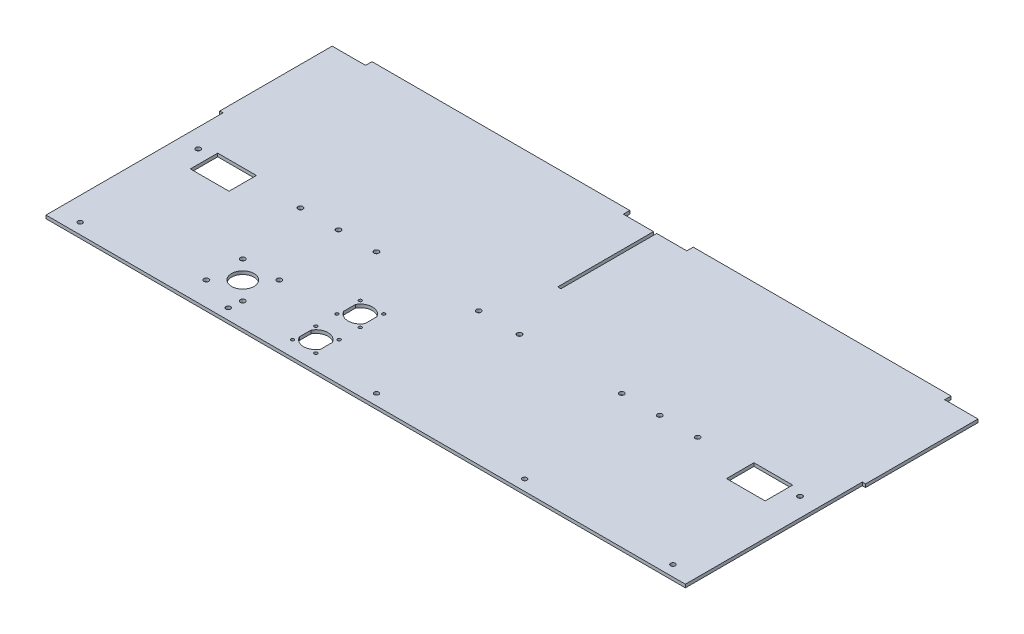
from build123d import *

# Parameters (mm, degrees)
SKETCH1_W            = 629.90984
SKETCH1_H            = 147.69846
BOSS_EXTRUDE1_DEPTH  = 3.175
SKETCH3_W            = 254
SKETCH3_H            = 3.175
BOSS_EXTRUDE2_DEPTH  = 6.35
SKETCH4_W            = 3.175
SKETCH4_H            = 188.732840052
CUT_EXTRUDE1_DEPTH   = 3.175
SKETCH6_W            = 3.175
SKETCH6_H            = 110.773845
BOSS_EXTRUDE4_DEPTH  = 3.175
SKETCH8_W            = 629.90984
SKETCH8_H            = 18.04416
BOSS_EXTRUDE5_DEPTH  = 3.175
SKETCH10_W           = 38.1
SKETCH10_H           = 36.08832
CUT_EXTRUDE3_DEPTH   = 652.56536379
BOSS_EXTRUDE6_DEPTH  = 3.175
SKETCH13_R           = 1.55
SKETCH13_R_2         = 11.049
CUT_EXTRUDE4_DEPTH   = 652.56536379
SKETCH20_W           = 20.59499956
SKETCH20_H           = 2.942142794
CUT_EXTRUDE7_DEPTH   = 1.27
SKETCH21_R           = 2.25
CUT_EXTRUDE8_DEPTH   = 652.56536379
SKETCH27_R           = 2.4
CUT_EXTRUDE12_DEPTH  = 652.56536379
M4_CLEARANCE_HOLE2_D = 4.8


with BuildPart() as part:
    # Sketch1 → Boss-Extrude1 (new body)
    with BuildSketch(Plane(origin=(0, 0, 0), x_dir=(1, 0, 0), z_dir=(0, 1, 0))):
        with Locations((314.95492, 73.84923)):
            Rectangle(SKETCH1_W, SKETCH1_H)
    extrude(amount=BOSS_EXTRUDE1_DEPTH)

    # Sketch3 → Boss-Extrude2 (add)
    with BuildSketch(Plane(origin=(0, 0, -147.69846), x_dir=(-1, 0, 0), z_dir=(0, 0, -1))):
        with Locations((-473.22613, 1.5875)):
            Rectangle(SKETCH3_W, SKETCH3_H)
        with Locations((-156.68371, 1.5875)):
            Rectangle(SKETCH3_W, SKETCH3_H)
    extrude(amount=BOSS_EXTRUDE2_DEPTH)

    # Sketch4 → Cut-Extrude1 (cut)
    with BuildSketch(Plane(origin=(0, 3.175, 0), x_dir=(1, 0, 0), z_dir=(0, 1, 0))):
        with Locations((314.95492, 147.69846)):
            Rectangle(SKETCH4_W, SKETCH4_H)
    extrude(amount=-CUT_EXTRUDE1_DEPTH, mode=Mode.SUBTRACT)

    # Sketch6 → Boss-Extrude4 (add)
    with BuildSketch(Plane(origin=(0, 3.175, 0), x_dir=(1, 0, 0), z_dir=(0, 1, 0))):
        with Locations((631.49734, 92.3115375)):
            Rectangle(SKETCH6_W, SKETCH6_H)
        with Locations((-1.5875, 92.3115375)):
            Rectangle(SKETCH6_W, SKETCH6_H)
    extrude(amount=-BOSS_EXTRUDE4_DEPTH)

    # Sketch8 → Boss-Extrude5 (add, through all)
    with BuildSketch(Plane(origin=(0, 3.175, 0), x_dir=(1, 0, 0), z_dir=(0, 1, 0))):
        with Locations((314.95492, -9.02208)):
            Rectangle(SKETCH8_W, SKETCH8_H)
    extrude(amount=-BOSS_EXTRUDE5_DEPTH)

    # Sketch10 → Cut-Extrude3 (cut, through all)
    with BuildSketch(Plane(origin=(0, 3.175, 0), x_dir=(1, 0, 0), z_dir=(0, 1, 0))):
        with Locations((579.10984, -18.04416)):
            Rectangle(SKETCH10_W, SKETCH10_H)
        with Locations((50.8, -18.04416)):
            Rectangle(SKETCH10_W, SKETCH10_H)
    extrude(amount=-CUT_EXTRUDE3_DEPTH, mode=Mode.SUBTRACT)

    # Sketch11 → Boss-Extrude6 (add, through all)
    with BuildSketch(Plane(origin=(0, 3.175, 0), x_dir=(1, 0, 0), z_dir=(0, 1, 0))):
        Polygon((0, -18.04416), (0, -137.42416), (629.90984, -137.42416), (629.90984, -18.04416), (598.15984, -18.04416), (598.15984, -27.06624), (560.05984, -27.06624), (560.05984, -18.04416), (386.39242, -18.04416), (348.29242, -18.04416), (281.61742, -18.04416), (243.51742, -18.04416), (69.85, -18.04416), (69.85, -26.95194), (31.75, -26.95194), (31.75, -18.04416), align=None)
    extrude(amount=-BOSS_EXTRUDE6_DEPTH)

    # Sketch13 → Cut-Extrude4 (cut, through all)
    with BuildSketch(Plane.XZ):
        with Locations(Location((227.731580951, 99.331796051, 0), (0, 0, 270))):
            Circle(SKETCH13_R)
        with Locations(Location((227.731580951, 122.331796051, 0), (0, 0, 270))):
            Circle(SKETCH13_R)
        with Locations(Location((250.731580951, 99.331796051, 0), (0, 0, 270))):
            Circle(SKETCH13_R)
        with Locations(Location((250.731580951, 122.331796051, 0), (0, 0, 270))):
            Circle(SKETCH13_R)
        with Locations(Location((152.328523542, 95.877856055, 0), (0, 0, 270))):
            Circle(SKETCH13_R_2)
        with Locations(Location((227.731580951, 78.511684621, 0), (0, 0, 270))):
            Circle(SKETCH13_R)
        with Locations(Location((227.731580951, 55.511684621, 0), (0, 0, 270))):
            Circle(SKETCH13_R)
        with Locations(Location((250.731580951, 55.511684621, 0), (0, 0, 270))):
            Circle(SKETCH13_R)
        with Locations(Location((250.731580951, 78.511684621, 0), (0, 0, 270))):
            Circle(SKETCH13_R)
        with BuildLine():
            Line((249.739580951, 116.643336294), (249.739580951, 105.020255807))
            ThreePointArc((249.739580951, 105.020255807), (239.231580951, 98.823796051), (228.723580951, 105.020255807))
            Line((228.723580951, 105.020255807), (228.723580951, 116.643336294))
            ThreePointArc((228.723580951, 116.643336294), (239.231580951, 122.839796051), (249.739580951, 116.643336294))
        make_face()
        with BuildLine():
            Line((249.739580951, 72.823224865), (249.739580951, 61.200144378))
            ThreePointArc((249.739580951, 61.200144378), (239.231580951, 55.003684621), (228.723580951, 61.200144378))
            Line((228.723580951, 61.200144378), (228.723580951, 72.823224865))
            ThreePointArc((228.723580951, 72.823224865), (239.231580951, 79.019684621), (249.739580951, 72.823224865))
        make_face()
    extrude(amount=-CUT_EXTRUDE4_DEPTH, mode=Mode.SUBTRACT)

    # Sketch20 → Cut-Extrude7 (cut)
    with BuildSketch(Plane.XZ):
        Polygon((269.946527362, 71.481147903), (278.936408122, 71.481147903), (278.936408122, 69.356266996), (269.946527362, 69.356266996), (269.946527362, 61.837457633), (266.18712268, 61.837457633), (266.18712268, 69.356266996), (258.341408562, 69.356266996), (258.341408562, 71.481147903), (266.18712268, 71.481147903), (266.18712268, 78.999957266), (269.946527362, 78.999957266), align=None)
        with Locations((268.638908342, 111.690432757)):
            Rectangle(SKETCH20_W, SKETCH20_H)
    extrude(amount=-CUT_EXTRUDE7_DEPTH, mode=Mode.SUBTRACT)

    # Sketch21 → Cut-Extrude8 (cut, through all)
    with BuildSketch(Plane(origin=(0, 3.175, 0), x_dir=(1, 0, 0), z_dir=(0, 1, 0))):
        with Locations(Location((168.943513391, -126.78664, 0), (0, 0, 270))):
            Circle(SKETCH21_R)
        with Locations(Location((314.95492, -126.78664, 0), (0, 0, 270))):
            Circle(SKETCH21_R)
        with Locations(Location((460.966326609, -126.78664, 0), (0, 0, 270))):
            Circle(SKETCH21_R)
        with Locations(Location((606.977733219, -126.78664, 0), (0, 0, 270))):
            Circle(SKETCH21_R)
        with Locations(Location((22.932106781, -126.78664, 0), (0, 0, 90))):
            Circle(SKETCH21_R)
    extrude(amount=-CUT_EXTRUDE8_DEPTH, mode=Mode.SUBTRACT)

    # Sketch27 → Cut-Extrude12 (cut, through all)
    with BuildSketch(Plane(origin=(0, 3.175, 0), x_dir=(1, 0, 0), z_dir=(0, 1, 0))):
        with Locations(Location((134.3680113, -77.917343813, 0), (0, 0, 270))):
            Circle(SKETCH27_R)
        with Locations(Location((170.289035784, -77.917343813, 0), (0, 0, 270))):
            Circle(SKETCH27_R)
        with Locations(Location((170.289035784, -113.838368298, 0), (0, 0, 270))):
            Circle(SKETCH27_R)
        with Locations(Location((134.3680113, -113.838368298, 0), (0, 0, 270))):
            Circle(SKETCH27_R)
    extrude(amount=-CUT_EXTRUDE12_DEPTH, mode=Mode.SUBTRACT)

    # M4 Clearance Hole2 (through all)
    with Locations(Plane(origin=(0, 3.175, 0), x_dir=(1, 0, 0), z_dir=(0, 1, 0))):
        with Locations((18.507533496, -5.996840051), (119.258944248, -5.996840051), (156.68371, -5.996840051), (194.108475752, -5.996840051), (294.860036505, -5.996840051), (335.049803495, -5.996840051), (435.801364248, -5.996840051), (473.22613, -5.996840051), (510.650895752, -5.996840051), (611.402306504, -5.996840051)):
            Hole(M4_CLEARANCE_HOLE2_D / 2)


solid = part.part
